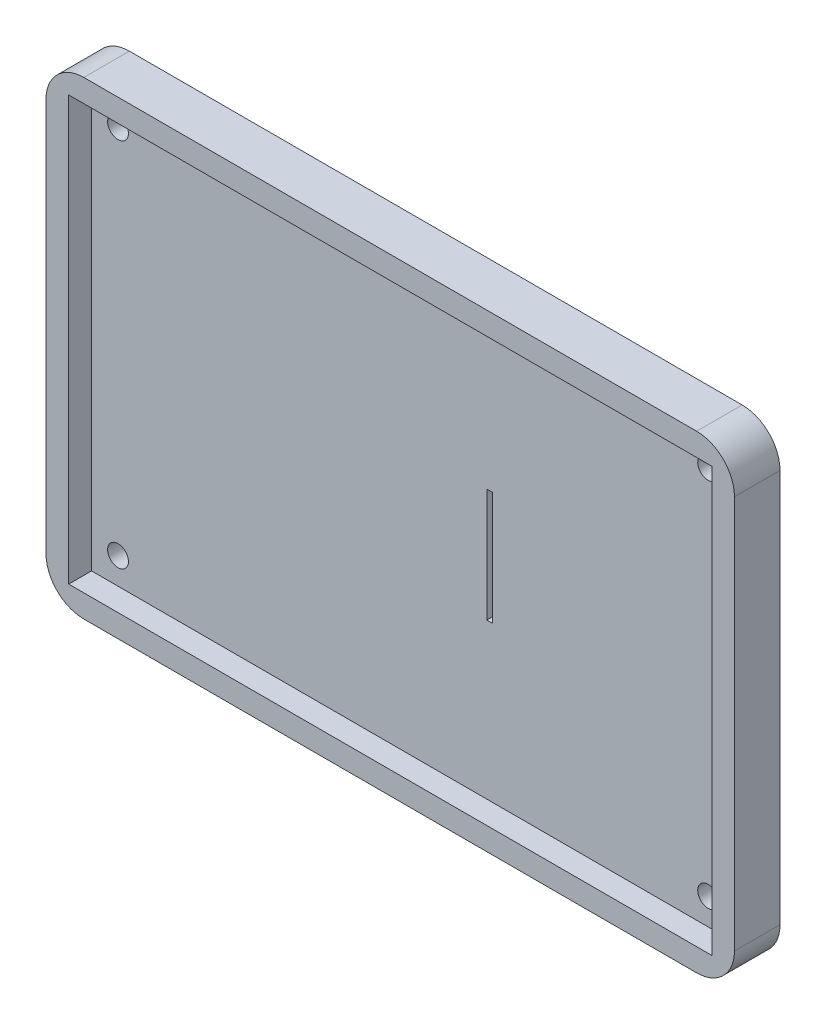
from build123d import *

# Parameters (mm, degrees)
SKETCH1_W           = 91
SKETCH1_H           = 62
SKETCH1_R           = 1.375
BOSS_EXTRUDE1_DEPTH = 3
SKETCH2_W           = 91
SKETCH2_H           = 62
SKETCH2_W_2         = 85
SKETCH2_H_2         = 56
BOSS_EXTRUDE2_DEPTH = 3.02
FILLET1_R           = 5
SKETCH3_W           = 0.75
SKETCH3_H           = 15
CUT_EXTRUDE1_DEPTH  = 3


with BuildPart() as part:
    # Sketch1 → Boss-Extrude1 (new body)
    with BuildSketch(Plane.XY):
        Rectangle(SKETCH1_W, SKETCH1_H)
        with Locations((-39, 24.5)):
            Circle(SKETCH1_R, mode=Mode.SUBTRACT)
        with Locations(Location((-39, -24.5, 0), (0, 0, 180))):
            Circle(SKETCH1_R, mode=Mode.SUBTRACT)
        with Locations((39, -24.5)):
            Circle(SKETCH1_R, mode=Mode.SUBTRACT)
        with Locations(Location((39, 24.5, 0), (0, 0, 180))):
            Circle(SKETCH1_R, mode=Mode.SUBTRACT)
    extrude(amount=BOSS_EXTRUDE1_DEPTH)

    # Sketch2 → Boss-Extrude2 (add)
    with BuildSketch(Plane.XY.offset(3)):
        Rectangle(SKETCH2_W, SKETCH2_H)
        Rectangle(SKETCH2_W_2, SKETCH2_H_2, mode=Mode.SUBTRACT)
    extrude(amount=BOSS_EXTRUDE2_DEPTH)

    # Fillet1
    fillet1_edges = [part.edges().sort_by_distance(p)[0] for p in [
        (45.5, -31, 3.01),
        (-45.5, -31, 3.01),
        (-45.5, 31, 3.01),
        (45.5, 31, 3.01),
    ]]
    fillet(fillet1_edges, radius=FILLET1_R)

    # Sketch3 → Cut-Extrude1 (cut)
    with BuildSketch(Plane(origin=(0, 0, 0), x_dir=(-1, 0, 0), z_dir=(0, 0, -1))):
        with Locations((-10.125, 0)):
            Rectangle(SKETCH3_W, SKETCH3_H)
    extrude(amount=-CUT_EXTRUDE1_DEPTH, mode=Mode.SUBTRACT)


solid = part.part
